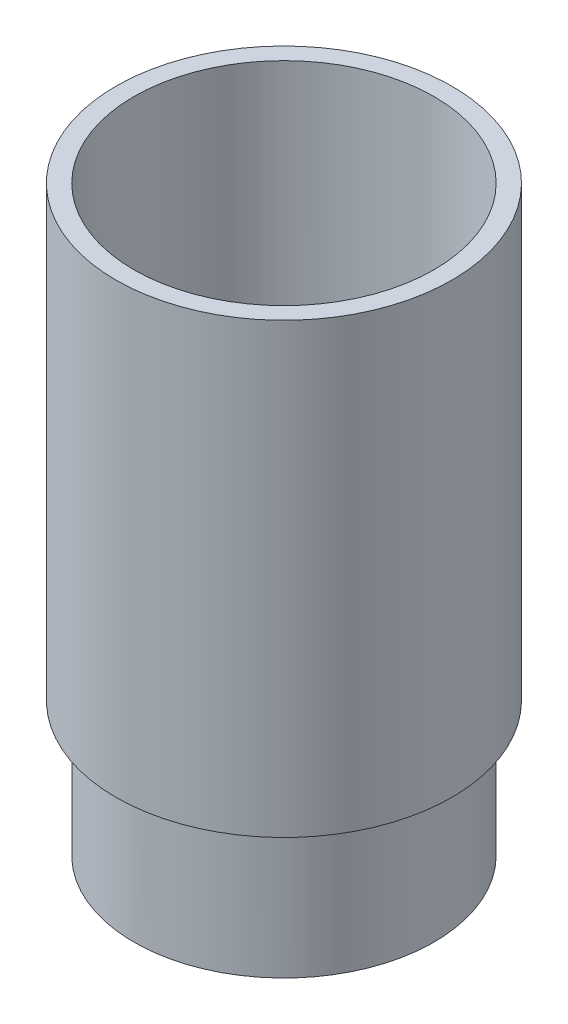
from build123d import *

# Parameters (mm, degrees)
SKETCH1_R                = 37.5
SKETCH1_R_2              = 33.5
BOSS_EXTRUDE1_DEPTH      = 100
BOSS_EXTRUDE2_DEPTH      = 30
BOSS_EXTRUDE2_DEPTH_BACK = 5
SKETCH2_R                = 33.5
SKETCH2_R_2              = 29.5


with BuildPart() as part:
    # Sketch1 → Boss-Extrude1 (new body)
    with BuildSketch(Plane(origin=(0, 0, 0), x_dir=(1, 0, 0), z_dir=(0, 1, 0))):
        with Locations(Location((0, 0, 0), (0, 0, 270))):
            Circle(SKETCH1_R)
        with Locations(Location((0, 0, 0), (0, 0, 270))):
            Circle(SKETCH1_R_2, mode=Mode.SUBTRACT)
    extrude(amount=BOSS_EXTRUDE1_DEPTH)

    # Sketch2 → Boss-Extrude2 (add, two sides: drawn at the far end of the back side and taken through both)
    with BuildSketch(Plane.XZ.offset(-BOSS_EXTRUDE2_DEPTH_BACK)):
        with Locations(Location((0, 0, 0), (0, 0, 270))):
            Circle(SKETCH2_R)
        with Locations(Location((0, 0, 0), (0, 0, 270))):
            Circle(SKETCH2_R_2, mode=Mode.SUBTRACT)
    extrude(amount=BOSS_EXTRUDE2_DEPTH + BOSS_EXTRUDE2_DEPTH_BACK)


solid = part.part
